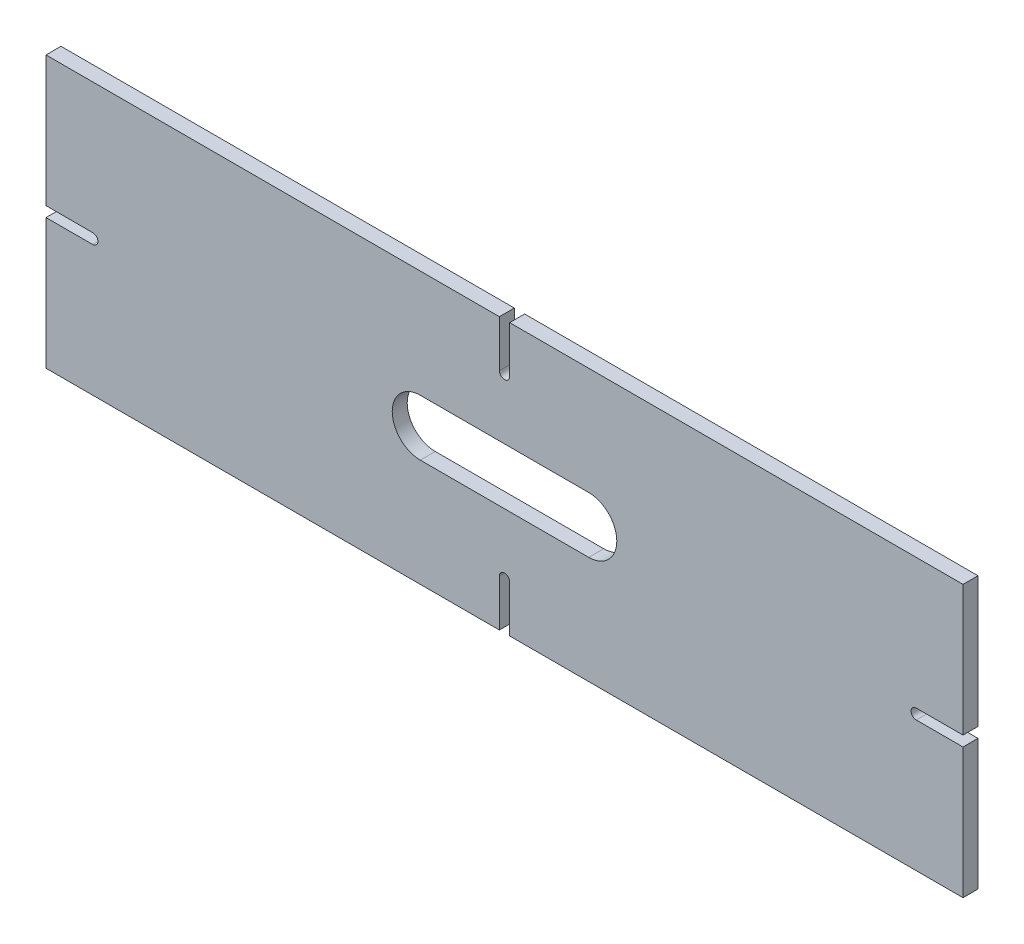
from build123d import *

# Parameters (mm, degrees)
BOSS_EXTRUDE3_DEPTH = 8


with BuildPart() as part:
    # Sketch1 → Boss-Extrude3 (new body)
    with BuildSketch(Plane.XY):
        with BuildLine():
            Line((-245, -2.75), (-245, -72.5))
            Line((-245, -72.5), (-2.75, -72.5))
            Line((-2.75, -72.5), (-2.75, -47.5))
            ThreePointArc((-2.75, -47.5), (0, -44.75), (2.75, -47.5))
            Line((2.75, -47.5), (2.75, -72.5))
            Line((2.75, -72.5), (245, -72.5))
            Line((245, -72.5), (245, -2.75))
            Line((245, -2.75), (220, -2.75))
            ThreePointArc((220, -2.75), (217.25, 0), (220, 2.75))
            Line((220, 2.75), (245, 2.75))
            Line((245, 2.75), (245, 72.5))
            Line((245, 72.5), (2.75, 72.5))
            Line((2.75, 72.5), (2.75, 47.5))
            ThreePointArc((2.75, 47.5), (0, 44.75), (-2.75, 47.5))
            Line((-2.75, 47.5), (-2.75, 72.5))
            Line((-2.75, 72.5), (-245, 72.5))
            Line((-245, 72.5), (-245, 2.75))
            Line((-245, 2.75), (-220, 2.75))
            ThreePointArc((-220, 2.75), (-217.25, 0), (-220, -2.75))
            Line((-220, -2.75), (-245, -2.75))
        make_face()
        with BuildLine():
            ThreePointArc((-45, -15), (-60, 0), (-45, 15))
            Line((-45, 15), (45, 15))
            ThreePointArc((45, 15), (60, 0), (45, -15))
            Line((45, -15), (-45, -15))
        make_face(mode=Mode.SUBTRACT)
    extrude(amount=BOSS_EXTRUDE3_DEPTH)


solid = part.part
